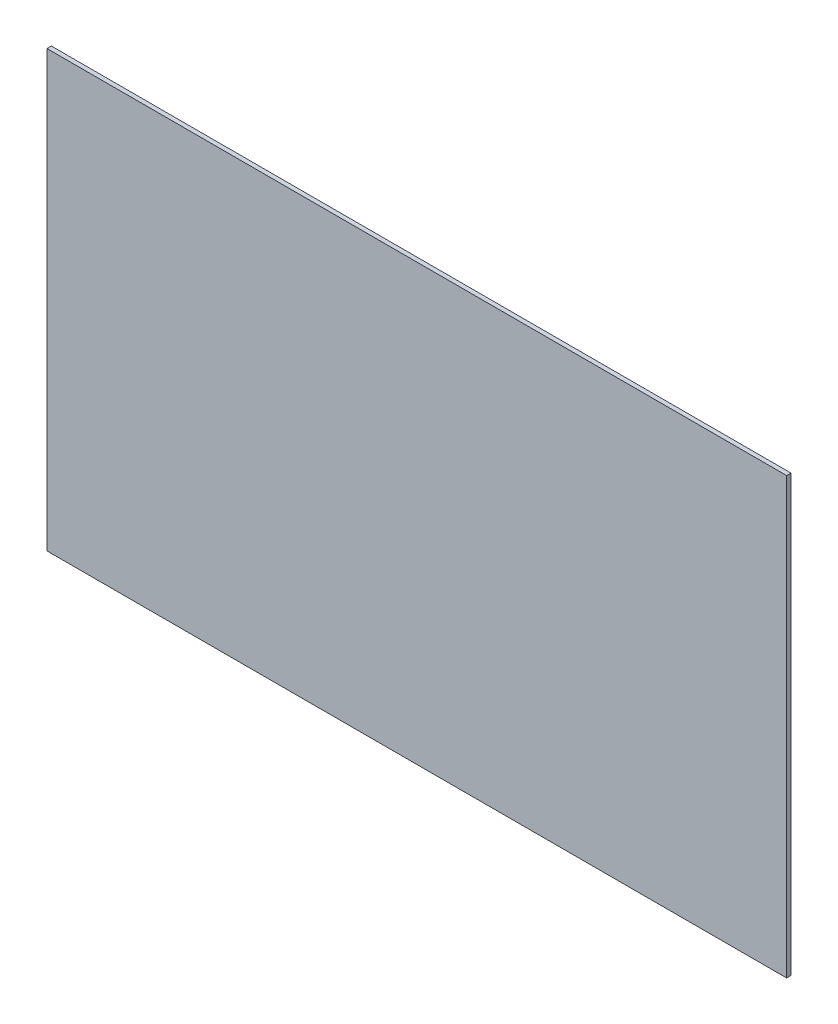
from build123d import *

# Parameters (mm, degrees)
ESQUISSE1_W        = 85
ESQUISSE1_H        = 50
BOSS_EXTRU_1_DEPTH = 0.5


with BuildPart() as part:
    # Esquisse1 → Boss.-Extru.1 (new body)
    with BuildSketch(Plane.XY):
        with Locations((42.5, 25)):
            Rectangle(ESQUISSE1_W, ESQUISSE1_H)
    extrude(amount=BOSS_EXTRU_1_DEPTH)


solid = part.part
